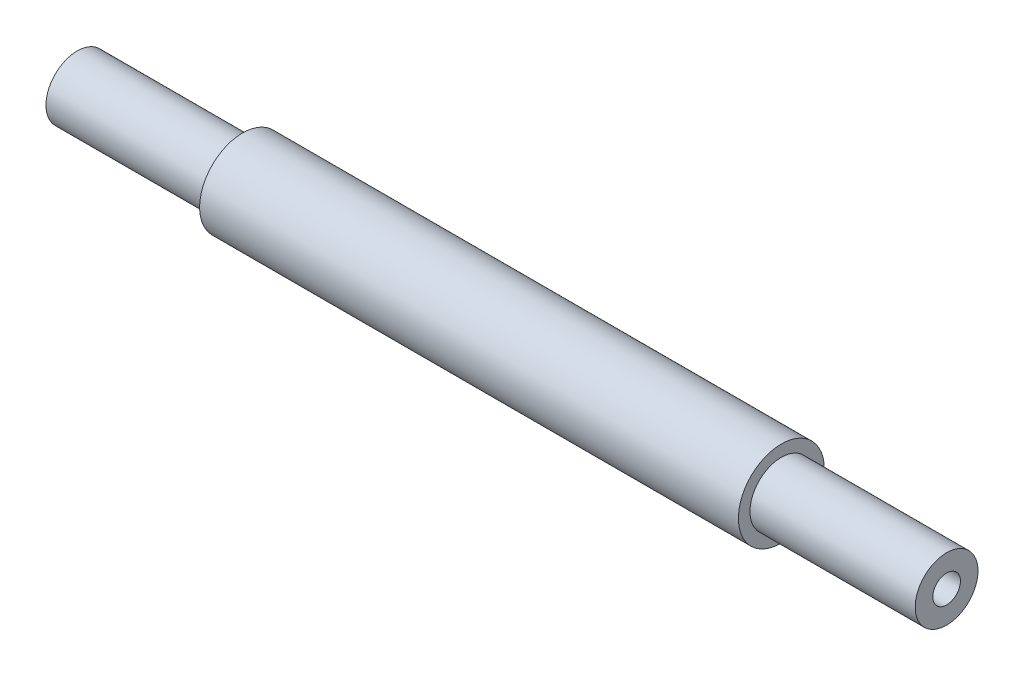
from build123d import *

# Parameters (mm, degrees)
SKETCH2_R           = 0.095
SKETCH2_R_2         = 0.041812836
BOSS_EXTRUDE1_DEPTH = 2.63
BOSS_EXTRUDE2_START = 0.5
SKETCH2_3_R         = 0.13
SKETCH2_3_R_2       = 0.095
BOSS_EXTRUDE2_DEPTH = 1.63


with BuildPart() as part:
    # Sketch2 → Boss-Extrude1 (new body)
    with BuildSketch(Plane(origin=(0, 0, 0), x_dir=(0, 0, -1), z_dir=(1, 0, 0))):
        Circle(SKETCH2_R)
        Circle(SKETCH2_R_2, mode=Mode.SUBTRACT)
    extrude(amount=BOSS_EXTRUDE1_DEPTH)

    # Sketch2<3> → Boss-Extrude2 (add)
    with BuildSketch(Plane(origin=(0, 0, 0), x_dir=(0, 0, -1), z_dir=(1, 0, 0)).offset(BOSS_EXTRUDE2_START)):
        Circle(SKETCH2_3_R)
        Circle(SKETCH2_3_R_2, mode=Mode.SUBTRACT)
    extrude(amount=BOSS_EXTRUDE2_DEPTH)


solid = part.part
